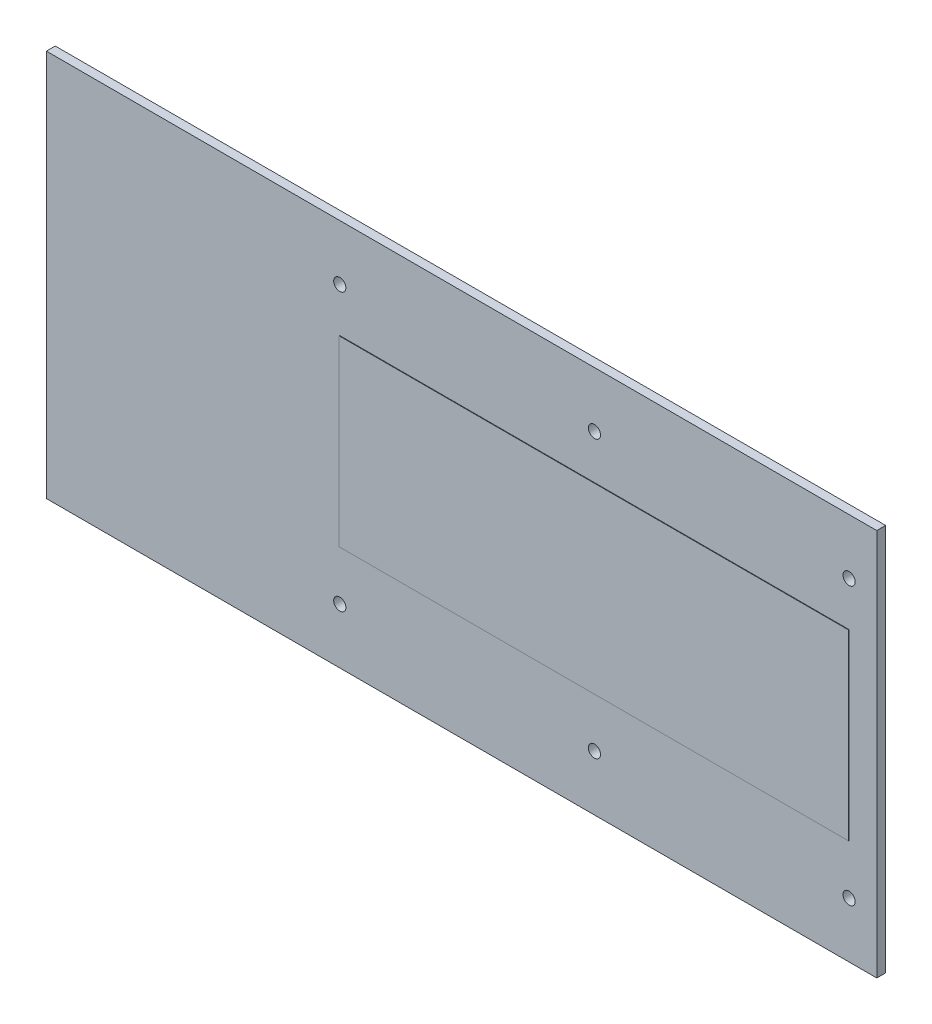
from build123d import *

# Parameters (mm, degrees)
SKETCH1_W           = 92
SKETCH1_H           = 33
BOSS_EXTRUDE1_DEPTH = 1.6
SKETCH2_W           = 92
SKETCH2_H           = 33
BOSS_EXTRUDE2_DEPTH = 0.1


with BuildPart() as part:
    # Sketch1 → Boss-Extrude1 (new body)
    with BuildSketch(Plane.XY):
        Polygon((48, 70), (150, 70), (150, 0), (48, 0), (46, 0), (0, 0), (0, 18.6), (0, 36), (0, 47), (0, 70), align=None)
        with Locations((99, 35.5)):
            Rectangle(SKETCH1_W, SKETCH1_H, mode=Mode.SUBTRACT)
        with BuildLine():
            ThreePointArc((99, 11.1), (97.9, 10), (99, 8.9))
            ThreePointArc((99, 8.9), (100.1, 10), (99, 11.1))
        make_face(mode=Mode.SUBTRACT)
        with BuildLine():
            ThreePointArc((99, 61.1), (97.9, 60), (99, 58.9))
            ThreePointArc((99, 58.9), (100.1, 60), (99, 61.1))
        make_face(mode=Mode.SUBTRACT)
        with BuildLine():
            ThreePointArc((53, 61.1), (51.9, 60), (53, 58.9))
            ThreePointArc((53, 58.9), (54.1, 60), (53, 61.1))
        make_face(mode=Mode.SUBTRACT)
        with BuildLine():
            ThreePointArc((53, 11.1), (51.9, 10), (53, 8.9))
            ThreePointArc((53, 8.9), (54.1, 10), (53, 11.1))
        make_face(mode=Mode.SUBTRACT)
        with BuildLine():
            ThreePointArc((145, 11.1), (143.9, 10), (145, 8.9))
            ThreePointArc((145, 8.9), (146.1, 10), (145, 11.1))
        make_face(mode=Mode.SUBTRACT)
        with BuildLine():
            ThreePointArc((145, 61.1), (143.9, 60), (145, 58.9))
            ThreePointArc((145, 58.9), (146.1, 60), (145, 61.1))
        make_face(mode=Mode.SUBTRACT)
    extrude(amount=BOSS_EXTRUDE1_DEPTH)


with BuildPart() as body_2:
    # Sketch2 → Boss-Extrude2 (new body)
    with BuildSketch(Plane.XY.offset(1.6)):
        with Locations((99, 35.5)):
            Rectangle(SKETCH2_W, SKETCH2_H)
    extrude(amount=BOSS_EXTRUDE2_DEPTH)


solid = Compound([part.part, body_2.part])
